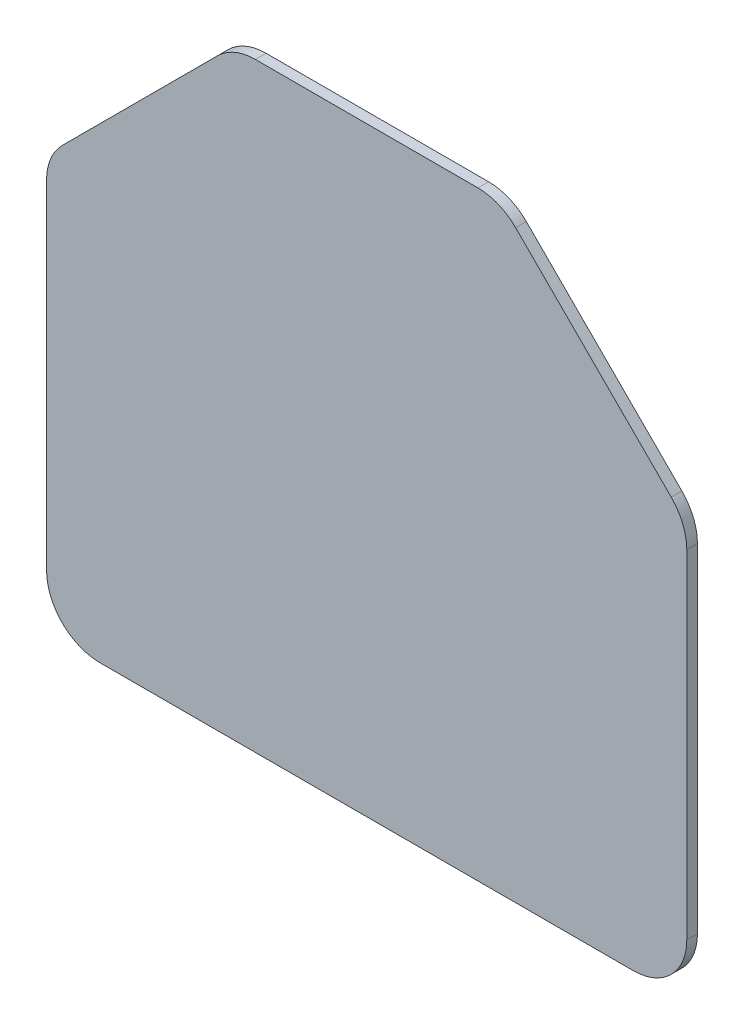
from build123d import *

# Parameters (mm, degrees)
EXTRUDE_1_DEPTH = 4


with BuildPart() as part:
    # 草图3 → 凸台-拉伸1 (new body)
    with BuildSketch(Plane.XY):
        with BuildLine():
            Line((73.505746565, 259.089488009), (156.93720407, 259.089488009))
            ThreePointArc((156.93720407, 259.089488009), (164.590872718, 257.56707866), (171.079339694, 253.231623633))
            Line((171.079339694, 253.231623633), (229.363610941, 194.947352386))
            ThreePointArc((229.363610941, 194.947352386), (233.699065968, 188.458885409), (235.221475318, 180.805216762))
            Line((235.221475318, 180.805216762), (235.221475318, 54.089488009))
            ThreePointArc((235.221475318, 54.089488009), (229.363610941, 39.947352386), (215.221475318, 34.089488009))
            Line((215.221475318, 34.089488009), (15.221475318, 34.089488009))
            ThreePointArc((15.221475318, 34.089488009), (1.079339694, 39.947352386), (-4.778524682, 54.089488009))
            Line((-4.778524682, 54.089488009), (-4.778524682, 180.805216762))
            ThreePointArc((-4.778524682, 180.805216762), (-3.256115333, 188.458885409), (1.079339694, 194.947352386))
            Line((1.079339694, 194.947352386), (59.363610941, 253.231623633))
            ThreePointArc((59.363610941, 253.231623633), (65.852077918, 257.56707866), (73.505746565, 259.089488009))
        make_face()
    extrude(amount=EXTRUDE_1_DEPTH)


solid = part.part
